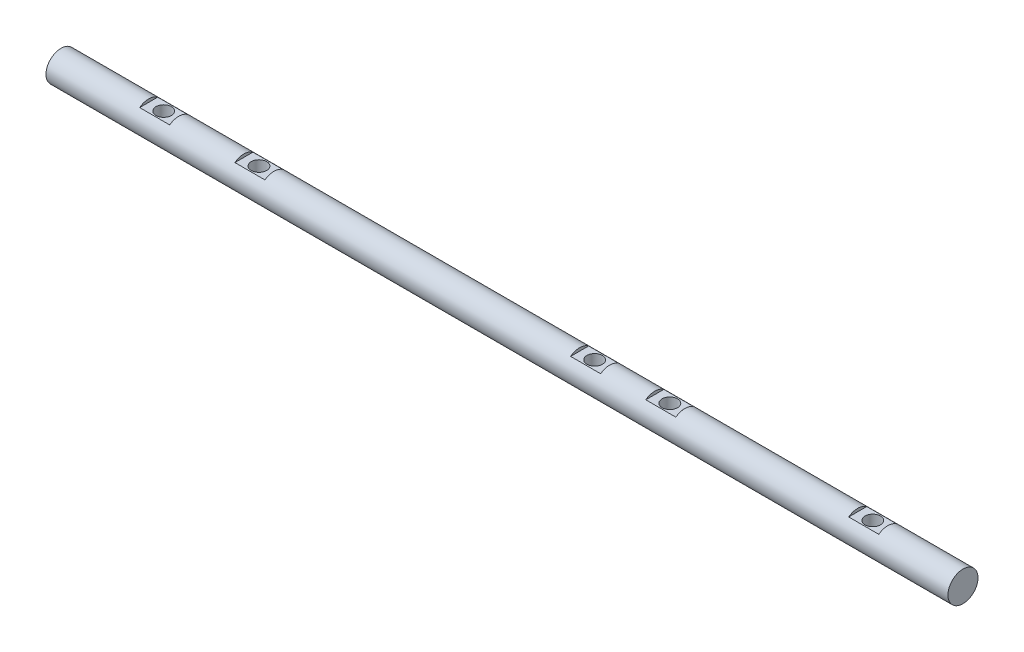
from build123d import *

# Parameters (mm, degrees)
SKETCH1_R               = 3.175
BOSS_EXTRUDE1_DEPTH     = 190.5
CUT_EXTRUDE1_DEPTH      = 191.552909319
CUT_EXTRUDE1_DEPTH_BACK = 191.552909319
SKETCH2_R               = 1.63195
CUT_EXTRUDE2_START      = 2.54
SKETCH2_3_W             = 6.35
SKETCH2_3_H             = 10.645264834
SKETCH2_3_R             = 1.63195
SKETCH2_3_H_2           = 13.84778105
SKETCH2_3_H_3           = 12.22562476
CUT_EXTRUDE2_DEPTH      = 189.012909422


with BuildPart() as part:
    # Sketch1 → Boss-Extrude1 (new body)
    with BuildSketch(Plane(origin=(0, 0, 0), x_dir=(0, 0, -1), z_dir=(1, 0, 0))):
        Circle(SKETCH1_R)
    extrude(amount=BOSS_EXTRUDE1_DEPTH)

    # Sketch2 → Cut-Extrude1 (cut, two sides: drawn at the far end of the back side and taken through both)
    with BuildSketch(Plane(origin=(0, 0, 0), x_dir=(1, 0, 0), z_dir=(0, 1, 0)).offset(-CUT_EXTRUDE1_DEPTH_BACK)):
        with Locations((21.6916, 0)):
            Circle(SKETCH2_R)
        with Locations((41.8084, 0)):
            Circle(SKETCH2_R)
        with Locations((112.71123, 0)):
            Circle(SKETCH2_R)
        with Locations((128.58877, 0)):
            Circle(SKETCH2_R)
        with Locations((171.45, 0)):
            Circle(SKETCH2_R)
    extrude(amount=CUT_EXTRUDE1_DEPTH + CUT_EXTRUDE1_DEPTH_BACK, mode=Mode.SUBTRACT)

    # Sketch2<3> → Cut-Extrude2 (cut, through all)
    # profile 1 of 5: a face of its own
    with BuildSketch(Plane(origin=(0, 0, 0), x_dir=(1, 0, 0), z_dir=(0, 1, 0)).offset(CUT_EXTRUDE2_START)):
        with Locations((41.8084, 0)):
            Rectangle(SKETCH2_3_W, SKETCH2_3_H)
        with Locations((41.8084, 0)):
            Circle(SKETCH2_3_R, mode=Mode.SUBTRACT)
    # profile 2 of 5: a face of its own
    with BuildSketch(Plane(origin=(0, 0, 0), x_dir=(1, 0, 0), z_dir=(0, 1, 0)).offset(CUT_EXTRUDE2_START)):
        with Locations((21.6916, 0)):
            Rectangle(SKETCH2_3_W, SKETCH2_3_H)
        with Locations((21.6916, 0)):
            Circle(SKETCH2_3_R, mode=Mode.SUBTRACT)
    # profile 3 of 5: a face of its own
    with BuildSketch(Plane(origin=(0, 0, 0), x_dir=(1, 0, 0), z_dir=(0, 1, 0)).offset(CUT_EXTRUDE2_START)):
        with Locations((128.58877, 0)):
            Rectangle(SKETCH2_3_W, SKETCH2_3_H_2)
        with Locations((128.58877, 0)):
            Circle(SKETCH2_3_R, mode=Mode.SUBTRACT)
    # profile 4 of 5: a face of its own
    with BuildSketch(Plane(origin=(0, 0, 0), x_dir=(1, 0, 0), z_dir=(0, 1, 0)).offset(CUT_EXTRUDE2_START)):
        with Locations((112.71123, 0)):
            Rectangle(SKETCH2_3_W, SKETCH2_3_H_2)
        with Locations((112.71123, 0)):
            Circle(SKETCH2_3_R, mode=Mode.SUBTRACT)
    # profile 5 of 5: a face of its own
    with BuildSketch(Plane(origin=(0, 0, 0), x_dir=(1, 0, 0), z_dir=(0, 1, 0)).offset(CUT_EXTRUDE2_START)):
        with Locations((171.45, 0)):
            Rectangle(SKETCH2_3_W, SKETCH2_3_H_3)
    extrude(amount=CUT_EXTRUDE2_DEPTH, mode=Mode.SUBTRACT)


solid = part.part
